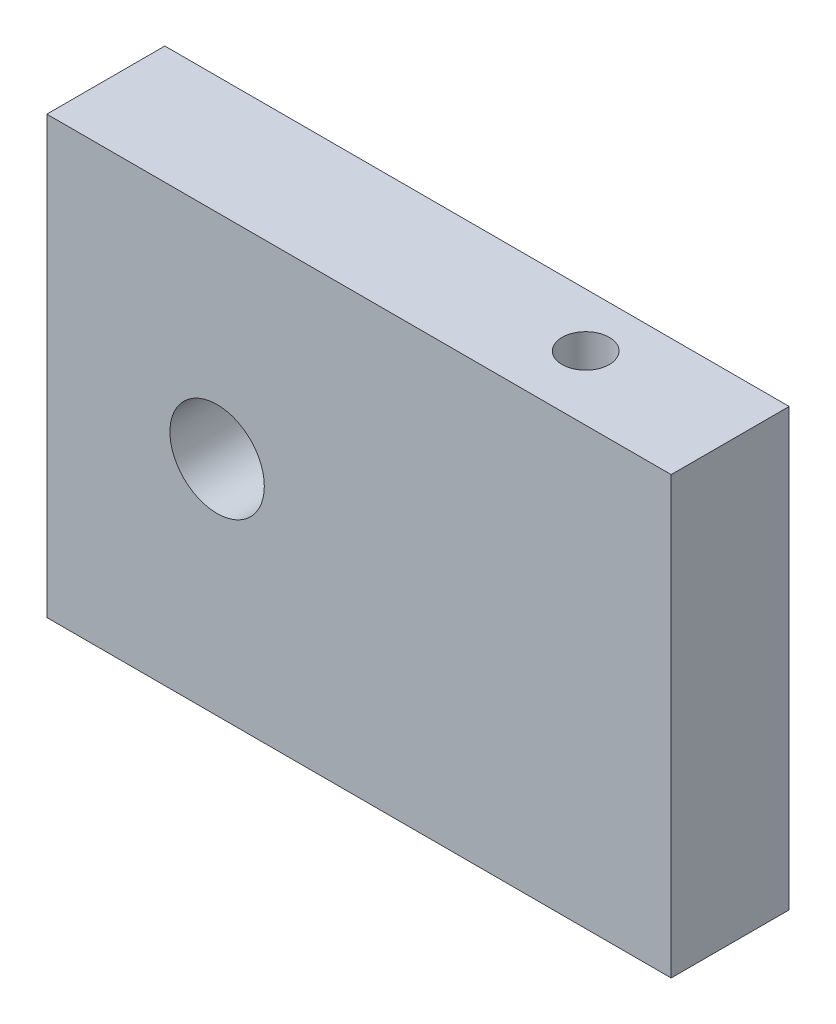
from build123d import *

# Parameters (mm, degrees)
SKETCH1_W              = 132.276038998
SKETCH1_H              = 92.368395504
BOSS_EXTRUDE1_DEPTH    = 25
F_20_0MM_DOWEL_HOLE1_D = 20
F_10_0MM_DOWEL_HOLE1_D = 10


with BuildPart() as part:
    # Sketch1 → Boss-Extrude1 (new body)
    with BuildSketch(Plane.XY):
        Rectangle(SKETCH1_W, SKETCH1_H)
    extrude(amount=BOSS_EXTRUDE1_DEPTH)

    # Ø20.0mm Dowel Hole1 (through all)
    with Locations(Plane.XY.offset(25)):
        with Locations((-30.059973271, 0.936294249)):
            Hole(F_20_0MM_DOWEL_HOLE1_D / 2)

    # Ø10.0mm Dowel Hole1 (through all)
    with Locations(Plane(origin=(0, 46.184197752, 0), x_dir=(1, 0, 0), z_dir=(0, 1, 0))):
        with Locations((34.396494005, -11.366591172)):
            Hole(F_10_0MM_DOWEL_HOLE1_D / 2)


solid = part.part
